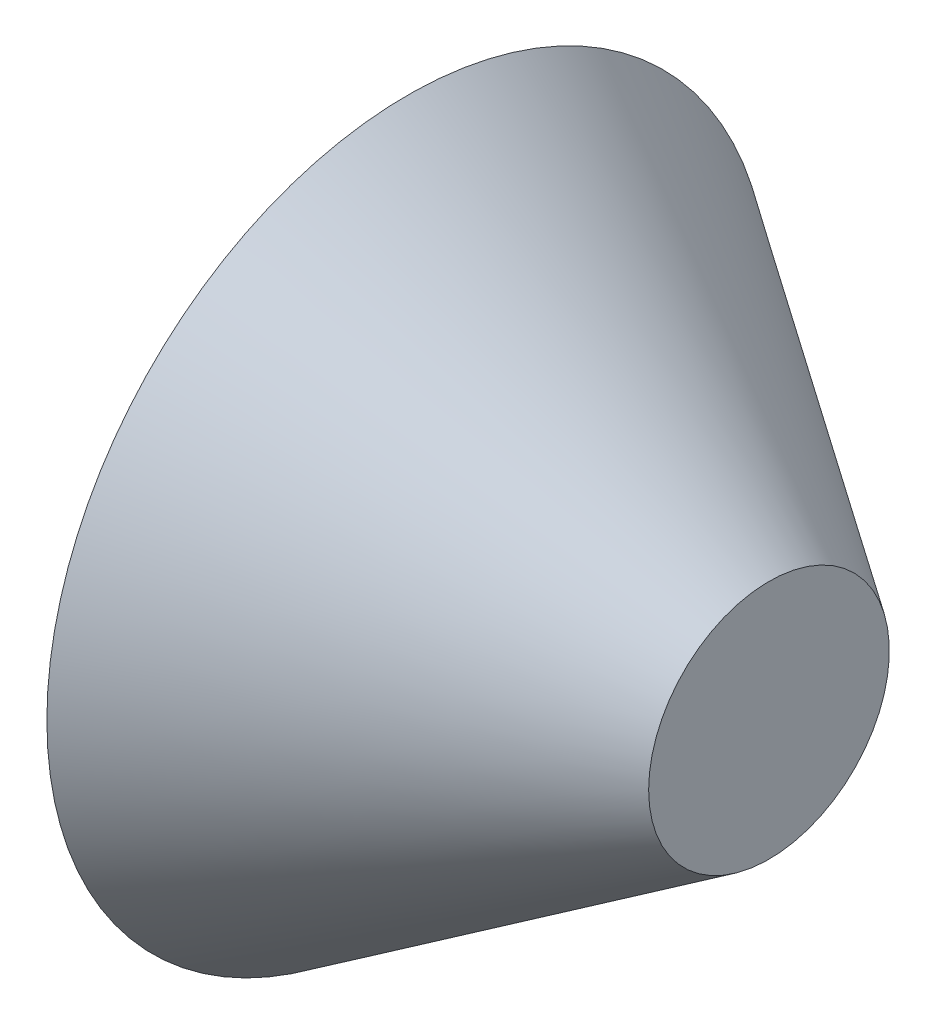
from build123d import *


with BuildPart() as part:
    # 草图1 → 旋转4 (revolve)
    with BuildSketch(Plane.XY, mode=Mode.PRIVATE) as revolve_4_sk:
        Polygon((-48.277671187, 30), (-18.277671187, 10), (-18.277671187, 0), (-20.277671187, 0), align=None)
    revolve(revolve_4_sk.sketch.rotate(Axis((-1153.69882865, 0, 0), (1, 0, 0)), 90), axis=Axis((-1153.69882865, 0, 0), (1, 0, 0)))


solid = part.part
